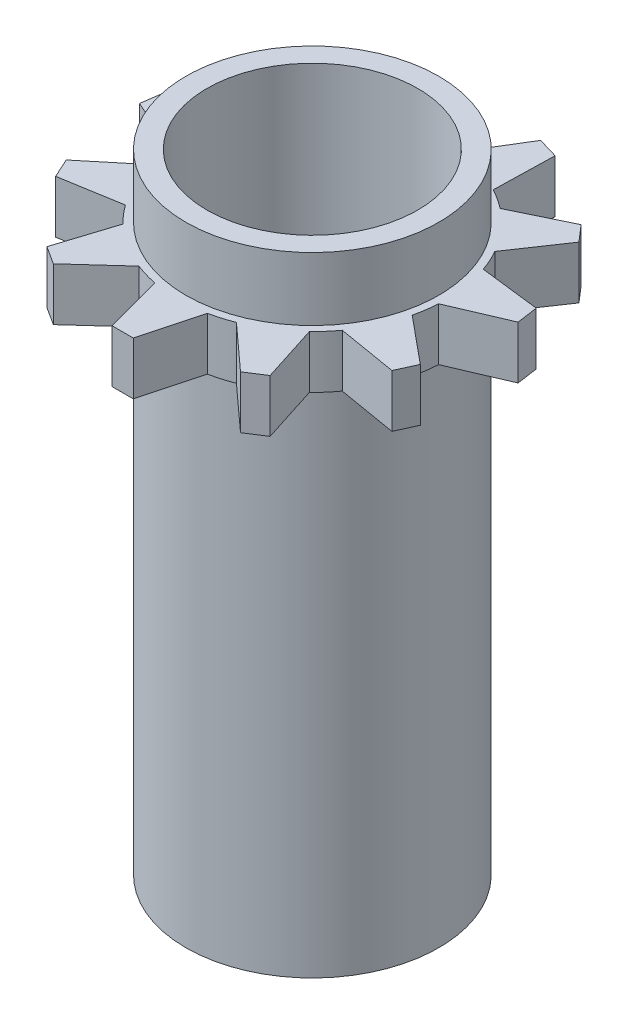
from build123d import *

# Parameters (mm, degrees)
SKETCH1_R               = 6
BOSS_EXTRUDE1_DEPTH     = 24.3
SKETCH8_R               = 6.35
BOSS_EXTRUDE5_DEPTH     = 2.5
BOSS_EXTRUDE6_DEPTH     = 2.5
CIRPATTERN1_COUNT       = 11
SKETCH10_R              = 6
BOSS_EXTRUDE7_DEPTH     = 3
CUT_EXTRUDE3_DEPTH      = 33.398962536
CUT_EXTRUDE3_DEPTH_BACK = 33.398962536
SKETCH11_R              = 5


with BuildPart() as part:
    # Sketch1 → Boss-Extrude1 (new body)
    with BuildSketch(Plane(origin=(0, 0, 0), x_dir=(1, 0, 0), z_dir=(0, 1, 0))):
        with Locations(Location((0, 0, 0), (0, 0, 270))):
            Circle(SKETCH1_R)
    extrude(amount=BOSS_EXTRUDE1_DEPTH)

    # Sketch8 → Boss-Extrude5 (add)
    with BuildSketch(Plane(origin=(0, 24.3, 0), x_dir=(-1, 0, 0), z_dir=(0, 1, 0))):
        with Locations(Location((0, 0, 0), (0, 0, 90))):
            Circle(SKETCH8_R)
    extrude(amount=BOSS_EXTRUDE5_DEPTH)

    # Sketch9 → Boss-Extrude6 (add)
    with BuildSketch(Plane(origin=(0, 26.8, 0), x_dir=(1, 0, 0), z_dir=(0, 1, 0))):
        Polygon((0.508, -9), (-0.508, -9), (-1.286124455, -6.096), (1.286124455, -6.096), align=None)
    boss_extrude6 = extrude(amount=-BOSS_EXTRUDE6_DEPTH)

    # CirPattern1: Boss-Extrude6 ×11 about axis
    cirpattern1_axis = Axis((0, 0, 0), (0, 1, 0))
    for i in range(1, CIRPATTERN1_COUNT):
        add(boss_extrude6.rotate(cirpattern1_axis, i * 360 / CIRPATTERN1_COUNT))

    # Sketch10 → Boss-Extrude7 (add)
    with BuildSketch(Plane(origin=(0, 26.8, 0), x_dir=(1, 0, 0), z_dir=(0, 1, 0))):
        with Locations(Location((0, 0, 0), (0, 0, 270))):
            Circle(SKETCH10_R)
    extrude(amount=BOSS_EXTRUDE7_DEPTH)

    # Sketch11 → Cut-Extrude3 (cut, two sides: drawn at the far end of the back side and taken through both)
    with BuildSketch(Plane(origin=(0, 29.8, 0), x_dir=(-1, 0, 0), z_dir=(0, 1, 0)).offset(-CUT_EXTRUDE3_DEPTH_BACK)):
        with Locations(Location((0, 0, 0), (0, 0, 90))):
            Circle(SKETCH11_R)
    extrude(amount=CUT_EXTRUDE3_DEPTH + CUT_EXTRUDE3_DEPTH_BACK, mode=Mode.SUBTRACT)


solid = part.part
